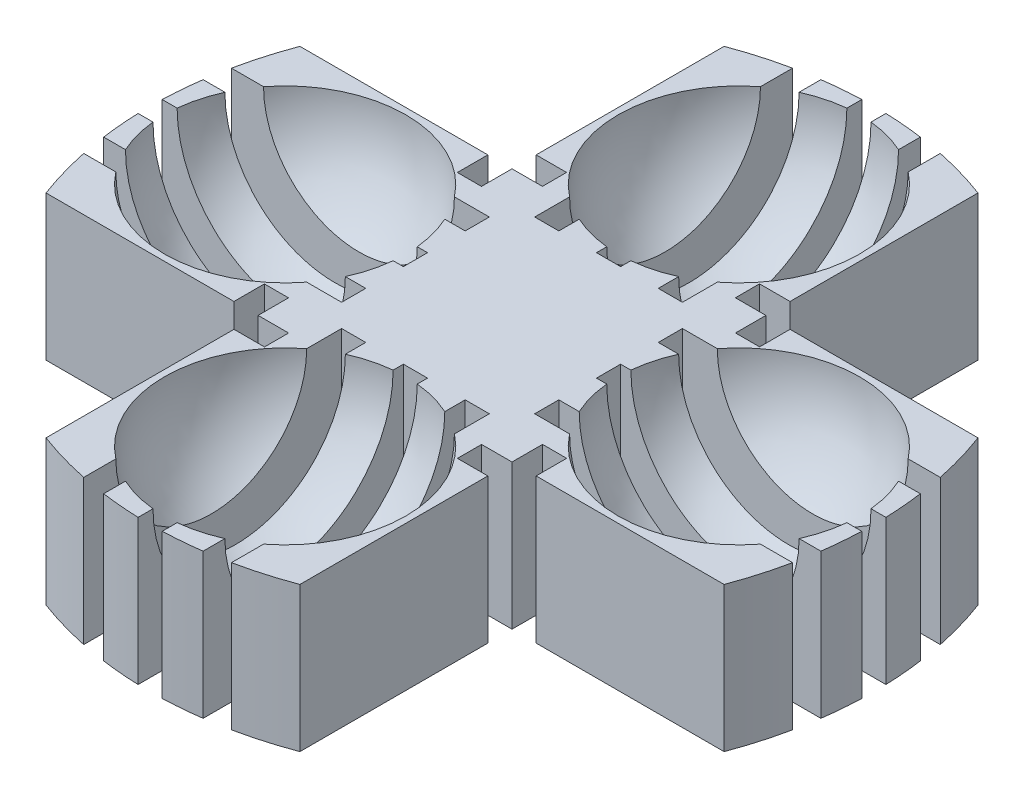
from build123d import *

# Parameters (mm, degrees)
BOSS_EXTRUDE1_DEPTH = 38.1
SKETCH7_W           = 6.35
SKETCH7_H           = 101.6
SKETCH7_H_2         = 100.875432805
CUT_EXTRUDE1_DEPTH  = 140.9883388
CIRPATTERN1_COUNT   = 4


with BuildPart() as part:
    # Sketch1 → Boss-Extrude1 (new body)
    with BuildSketch(Plane(origin=(0, 0, 0), x_dir=(1, 0, 0), z_dir=(0, 1, 0))):
        with BuildLine():
            Line((-33.444507811, 89.185354163), (-33.444507811, 33.696150168))
            Line((-33.444507811, 33.696150168), (-89.090582913, 33.696150168))
            ThreePointArc((-89.090582913, 33.696150168), (-95.25, 0), (-89.090582913, -33.696150168))
            Line((-89.090582913, -33.696150168), (-33.444507811, -33.696150168))
            Line((-33.444507811, -33.696150168), (-33.444507811, -89.185354163))
            ThreePointArc((-33.444507811, -89.185354163), (0, -95.25), (33.444507811, -89.185354163))
            Line((33.444507811, -89.185354163), (33.444507811, -33.696150168))
            Line((33.444507811, -33.696150168), (89.090582913, -33.696150168))
            ThreePointArc((89.090582913, -33.696150168), (95.25, 0), (89.090582913, 33.696150168))
            Line((89.090582913, 33.696150168), (33.444507811, 33.696150168))
            Line((33.444507811, 33.696150168), (33.444507811, 89.185354163))
            ThreePointArc((33.444507811, 89.185354163), (0, 95.25), (-33.444507811, 89.185354163))
        make_face()
    extrude(amount=-BOSS_EXTRUDE1_DEPTH)

    # Sketch3 → Cut-Revolve3 (revolve, cut)
    with BuildSketch(Plane.XY.offset(59.69)):
        with BuildLine():
            Line((0, 0), (0, -31.75))
            ThreePointArc((0, -31.75), (22.450640303, -22.450640303), (31.75, 0))
            Line((31.75, 0), (0, 0))
        make_face()
    cut_revolve3 = revolve(axis=Axis((0, 0, 59.69), (0, -1, 0)), mode=Mode.SUBTRACT)

    # Sketch7 → Cut-Extrude1 (cut, through all)
    with BuildSketch(Plane(origin=(0, 0, 0), x_dir=(1, 0, 0), z_dir=(0, 1, 0))):
        with Locations((-16.256, -76.2)):
            Rectangle(SKETCH7_W, SKETCH7_H)
        with Locations((0, -76.2)):
            Rectangle(SKETCH7_W, SKETCH7_H)
        with Locations((16.256, -75.837716403)):
            Rectangle(SKETCH7_W, SKETCH7_H_2)
        with Locations((36.576, -76.171178844)):
            Rectangle(SKETCH7_W, SKETCH7_H)
        with Locations((-36.576, -76.2)):
            Rectangle(SKETCH7_W, SKETCH7_H)
    cut_extrude1 = extrude(amount=-CUT_EXTRUDE1_DEPTH, mode=Mode.SUBTRACT)

    # CirPattern1: Cut-Revolve3, Cut-Extrude1 ×4 about axis
    cirpattern1_axis = Axis((0, 0, 0), (0, 1, 0))
    add([cut_revolve3.rotate(cirpattern1_axis, i * 360 / CIRPATTERN1_COUNT) for i in range(1, CIRPATTERN1_COUNT)], mode=Mode.SUBTRACT)
    add([cut_extrude1.rotate(cirpattern1_axis, i * 360 / CIRPATTERN1_COUNT) for i in range(1, CIRPATTERN1_COUNT)], mode=Mode.SUBTRACT)


solid = part.part
